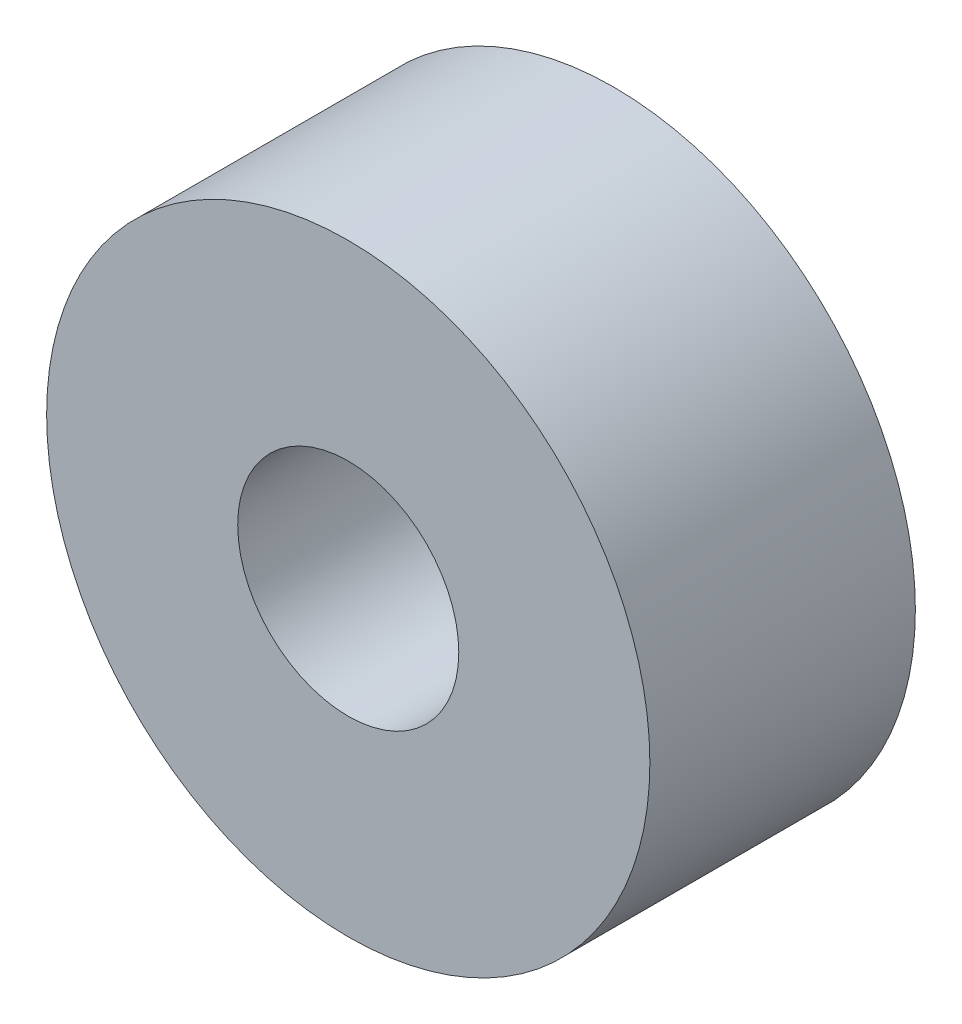
from build123d import *

# Parameters (mm, degrees)
SKETCH1_R           = 8.35
BOSS_EXTRUDE1_DEPTH = 7.35
SKETCH2_R           = 3.06
CUT_EXTRUDE1_DEPTH  = 14.909259506


with BuildPart() as part:
    # Sketch1 → Boss-Extrude1 (new body)
    with BuildSketch(Plane.XY):
        Circle(SKETCH1_R)
    extrude(amount=BOSS_EXTRUDE1_DEPTH)

    # Sketch2 → Cut-Extrude1 (cut, through all)
    with BuildSketch(Plane.XY.offset(7.35)):
        Circle(SKETCH2_R)
    extrude(amount=-CUT_EXTRUDE1_DEPTH, mode=Mode.SUBTRACT)


solid = part.part
